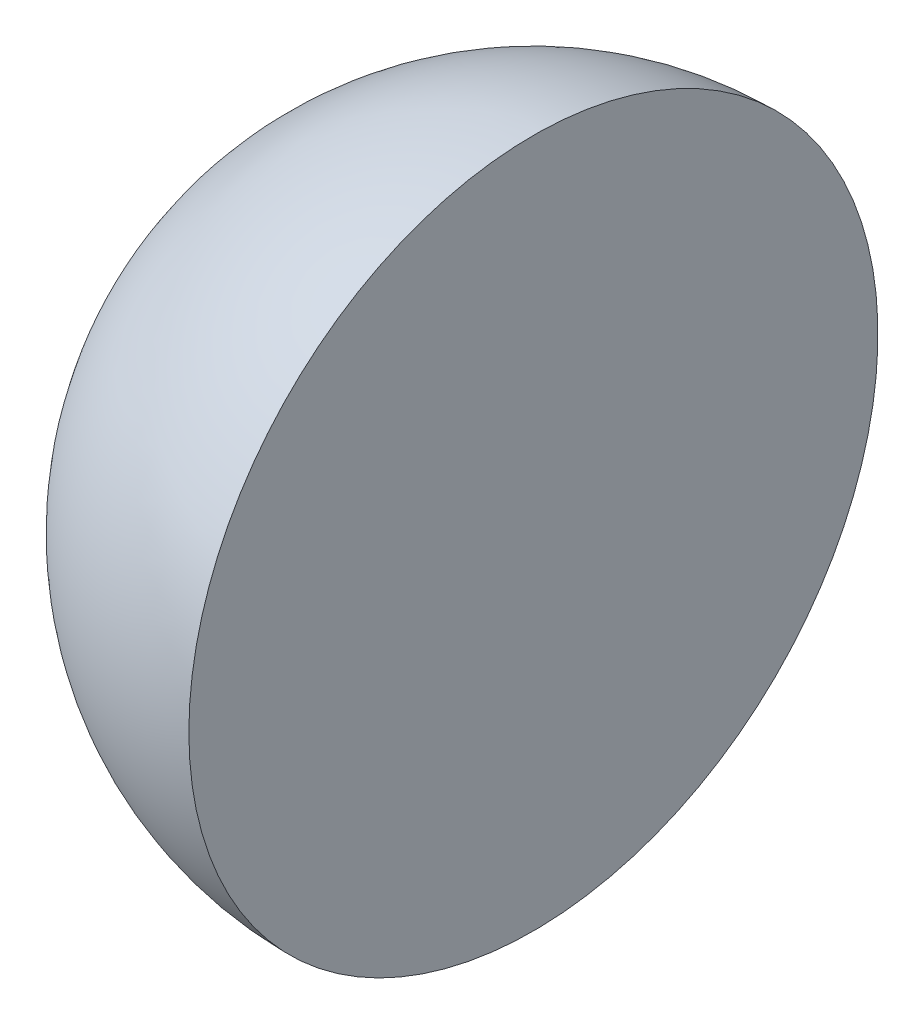
from build123d import *

# Parameters (mm, degrees)
REVOLVE1_ANGLE = 180


with BuildPart() as part:
    # Sketch2 → Revolve1 (revolve)
    with BuildSketch(Plane(origin=(0, 0, 0), x_dir=(0, 0, -1), z_dir=(1, 0, 0))):
        with BuildLine():
            Line((-25.4, 0), (25.4, 0))
            ThreePointArc((25.4, 0), (0, -25.4), (-25.4, 0))
        make_face()
    revolve(axis=Axis((0, 0, 25.4), (0, 0, -1)), revolution_arc=REVOLVE1_ANGLE)


solid = part.part
